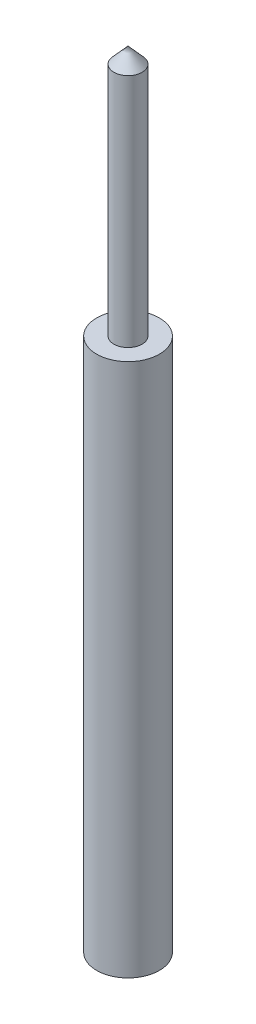
from build123d import *


with BuildPart() as part:
    # Esquisse1 → Révolution1 (revolve)
    with BuildSketch(Plane.XY, mode=Mode.PRIVATE) as r_volution1_sk:
        Polygon((0, 25), (0.45, 24.5), (0.45, 17), (1, 17), (1, 0), (0, 0), align=None)
    revolve(r_volution1_sk.sketch.rotate(Axis((0, 0, 0), (0, 1, 0)), 90), axis=Axis((0, 0, 0), (0, 1, 0)))


solid = part.part
